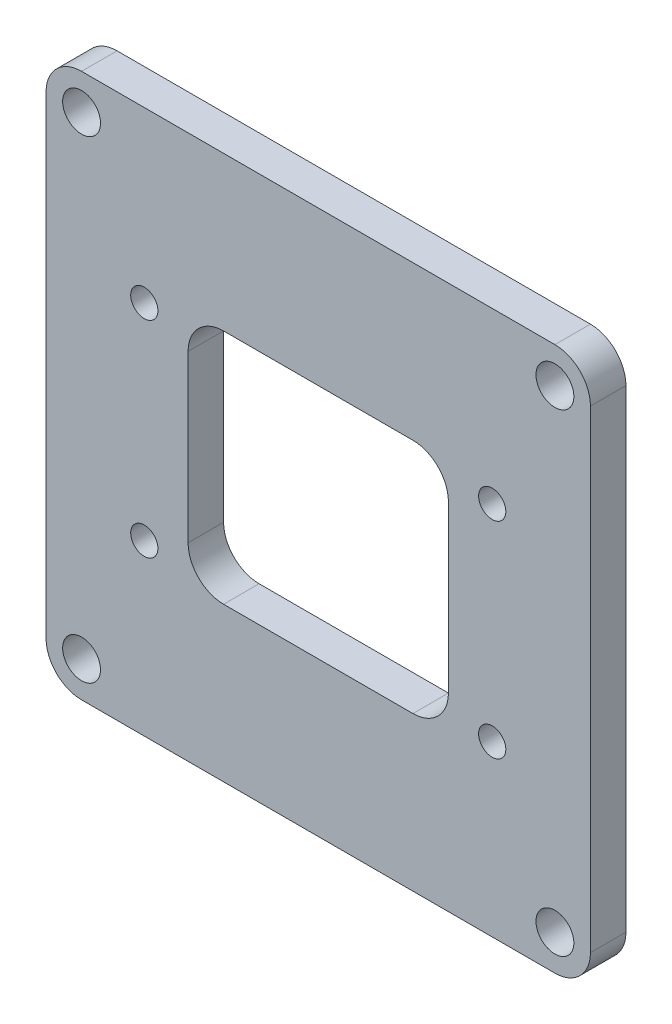
from build123d import *

# Parameters (mm, degrees)
SKETCH_1_W          = 46
SKETCH_1_H          = 46
SKETCH_1_R          = 1.6
SKETCH_1_R_2        = 1.15
EXTRUDE_1_DEPTH     = 3
FILLET_1_R          = 3
SKETCH_2_W          = 22
SKETCH_2_H          = 20
CUT_EXTRUDE_1_DEPTH = 3
FILLET_2_R          = 3


with BuildPart() as part:
    # 草图1 → 凸台-拉伸1 (new body)
    with BuildSketch(Plane.XY):
        Rectangle(SKETCH_1_W, SKETCH_1_H)
        with Locations((-20, 20)):
            Circle(SKETCH_1_R, mode=Mode.SUBTRACT)
        with Locations((20, 20)):
            Circle(SKETCH_1_R, mode=Mode.SUBTRACT)
        with Locations((20, -20)):
            Circle(SKETCH_1_R, mode=Mode.SUBTRACT)
        with Locations((-20, -20)):
            Circle(SKETCH_1_R, mode=Mode.SUBTRACT)
        with Locations((-14.7, 8.7)):
            Circle(SKETCH_1_R_2, mode=Mode.SUBTRACT)
        with Locations((14.7, 8.7)):
            Circle(SKETCH_1_R_2, mode=Mode.SUBTRACT)
        with Locations((14.7, -8.7)):
            Circle(SKETCH_1_R_2, mode=Mode.SUBTRACT)
        with Locations((-14.7, -8.7)):
            Circle(SKETCH_1_R_2, mode=Mode.SUBTRACT)
    extrude(amount=EXTRUDE_1_DEPTH)

    # 圆角1
    fillet_1_edges = [part.edges().sort_by_distance(p)[0] for p in [
        (-23, 23, 1.5),
        (23, 23, 1.5),
        (23, -23, 1.5),
        (-23, -23, 1.5),
    ]]
    fillet(fillet_1_edges, radius=FILLET_1_R)

    # 草图2 → 切除-拉伸1 (cut)
    with BuildSketch(Plane.XY.offset(3)):
        Rectangle(SKETCH_2_W, SKETCH_2_H)
    extrude(amount=-CUT_EXTRUDE_1_DEPTH, mode=Mode.SUBTRACT)

    # 圆角2
    fillet_2_edges = [part.edges().sort_by_distance(p)[0] for p in [
        (-11, -10, 1.5),
        (-11, 10, 1.5),
        (11, 10, 1.5),
        (11, -10, 1.5),
    ]]
    fillet(fillet_2_edges, radius=FILLET_2_R)


solid = part.part
